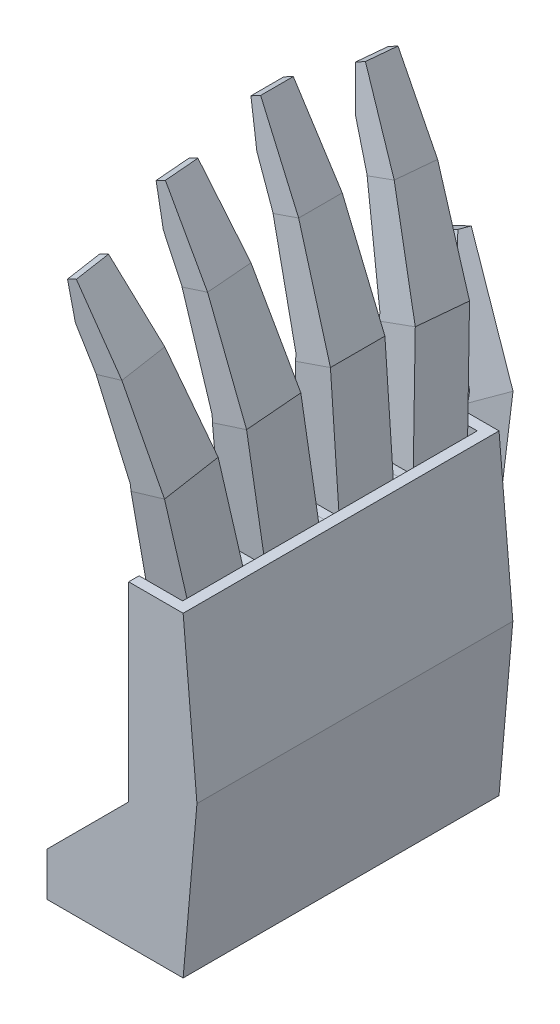
from build123d import *

# Parameters (mm, degrees)
EXTRUDE_1_DEPTH      = 29
CUT_EXTRUDE_1_DEPTH  = 8
EXTRUDE_3_DEPTH      = 5
EXTRUDE_4_DEPTH      = 5
EXTRUDE_7_DEPTH      = 5
EXTRUDE_8_DEPTH      = 5
CUT_EXTRUDE_2_DEPTH  = 8
CUT_EXTRUDE_3_DEPTH  = 8
CUT_EXTRUDE_4_DEPTH  = 8
CUT_EXTRUDE_5_DEPTH  = 8
EXTRUDE_9_DEPTH      = 4
EXTRUDE_9_DEPTH_BACK = 15
CUT_EXTRUDE_6_DEPTH  = 123.591294734
EXTRUDE_10_DEPTH     = 12
CUT_EXTRUDE_7_DEPTH  = 10
CUT_EXTRUDE_8_REACH  = 131.356
SKETCH_19_R          = 4
SKETCH_19_R_2        = 0.75
CUT_EXTRUDE_9_REACH  = 128.701
SKETCH_20_R          = 1.459599559
SKETCH_20_R_2        = 1.556195018
SKETCH_20_R_3        = 1.5


with BuildPart() as part:
    # 草图1 → 凸台-拉伸1 (new, symmetric)
    with BuildSketch(Plane.XY):
        Polygon((0, 0), (25, 0), (27.537171242, 29), (25, 58), (15, 58), (15, 23), (0, 8), align=None)
    extrude(amount=EXTRUDE_1_DEPTH, both=True)

    # 草图2 → 切除-拉伸1 (cut)
    with BuildSketch(Plane.ZY.offset(-15)):
        Polygon((-27, 58), (-27, 55.814681899), (-13.451752106, 57), (0.148247894, 57), (13.696495788, 55.814681899), (27.089881229, 53.453066682), (27.089881229, 58), align=None)
    extrude(amount=-CUT_EXTRUDE_1_DEPTH, mode=Mode.SUBTRACT)

    # 草图3 → 凸台-拉伸3 (add, symmetric)
    with BuildSketch(Plane(origin=(15, 56.407340949, -20.225876053), x_dir=(1, 0, 0), z_dir=(0, 0.08715574274765847, 0.9961946980917457))):
        Polygon((-9.323445702, 54.044998978), (-8.171455002, 46.660954361), (-4.917561857, 39.352590699), (0, 21), (0, 0), (8, 0), (6.465357578, 21.946409106), (-0.046005512, 40.856780618), (-7.557550516, 54.983942103), align=None)
    extrude(amount=EXTRUDE_3_DEPTH, both=True)

    # 草图4 → 凸台-拉伸4 (add, symmetric)
    with BuildSketch(Plane(origin=(15, 57, -6.651752106), x_dir=(1, 0, 0), z_dir=(0, 0, 1))):
        Polygon((0, 0), (8, 0), (6.395601104, 22.943973156), (-0.44133014, 42.799863244), (-8.422346707, 57.809972322), (-10.188241893, 56.871029197), (-8.633642368, 49.083652916), (-5.176380902, 41.318516526), (0, 22), align=None)
    extrude(amount=EXTRUDE_4_DEPTH, both=True)

    # 草图5 → 凸台-拉伸7 (add, symmetric)
    with BuildSketch(Plane(origin=(15, 56.407340949, 6.922371841), x_dir=(1, 0, 0), z_dir=(0, -0.08715574274765847, 0.9961946980917457))):
        Polygon((0, 0), (8, 0), (6.465357578, 21.946409106), (-0.046005512, 40.856780618), (-7.557550516, 54.983942103), (-9.323445702, 54.044998978), (-8.171455002, 46.660954361), (-4.917561857, 39.352590699), (0, 21), align=None)
    extrude(amount=EXTRUDE_7_DEPTH, both=True)

    # 草图6 → 凸台-拉伸8 (add, symmetric)
    with BuildSketch(Plane(origin=(15, 54.63387429, 20.393188509), x_dir=(1, 0, 0), z_dir=(0, -0.17364817766693064, 0.9848077530122081))):
        Polygon((0, 0), (8, 0), (6.535114051, 20.948845055), (0.674887271, 37.968179416), (-6.367186171, 51.212393309), (-8.133081356, 50.273450184), (-7.45044859, 43.272329979), (-4.399923767, 36.420739047), (0, 20), align=None)
    extrude(amount=EXTRUDE_8_DEPTH, both=True)

    # 草图9 → 切除-拉伸2 (cut)
    with BuildSketch(Plane(origin=(43.786407244, 15.019497062, -1.314035725), x_dir=(-0.027653196730496193, -0.006835672416694662, -0.9995942048117308), z_dir=(0.945518575599319, 0.32432926933772815, -0.028375134316697356))):
        Polygon((16.019101355, 67.443389025), (18.714253027, 87.286175055), (21.05291991, 102.947141542), (27.031237201, 102.437511905), (26.685342748, 86.606668873), (25.982963507, 66.594006296), (29.629783933, 109.373797793), (19.665921781, 110.223180522), align=None)
    extrude(amount=-CUT_EXTRUDE_2_DEPTH, mode=Mode.SUBTRACT)

    # 草图10 → 切除-拉伸3 (cut)
    with BuildSketch(Plane(origin=(43.736994655, 15.059854982, 0), x_dir=(0, 0, -1), z_dir=(0.9455185755993187, 0.32556815445715115, 0))):
        Polygon((1.651752106, 68.622785261), (2.651752106, 89.622785261), (3.651752106, 106.413487051), (9.651752106, 106.413487051), (10.651752106, 89.622785261), (11.651752106, 68.622785261), (11.651752106, 115.571899367), (1.651752106, 115.571899367), align=None)
    extrude(amount=-CUT_EXTRUDE_3_DEPTH, mode=Mode.SUBTRACT)

    # 草图11 → 切除-拉伸4 (cut)
    with BuildSketch(Plane(origin=(43.429484648, 14.897066422, 1.303324432), x_dir=(0.02765319673049623, 0.006835672416694678, -0.9995942048117308), z_dir=(0.9455185755993187, 0.32432926933772854, 0.028375134316697394))):
        Polygon((-12.684857793, 66.627338038), (-13.387237034, 86.640000614), (-13.733131487, 102.470843646), (-7.754814196, 102.980473283), (-5.416147313, 87.319506797), (-2.720995641, 67.476720766), (-6.546649191, 112.354351713), (-16.478235605, 111.126351676), align=None)
    extrude(amount=-CUT_EXTRUDE_4_DEPTH, mode=Mode.SUBTRACT)

    # 草图12 → 切除-拉伸5 (cut)
    with BuildSketch(Plane(origin=(43.353791536, 14.701119108, 2.592203945), x_dir=(0.05512742044977168, 0.013471340172277213, -0.9983884467022428), z_dir=(0.9455185755993187, 0.32062204264327854, 0.0565343167278701))):
        Polygon((-26.718901534, 63.408631661), (-28.781224347, 81.318037698), (-30.304296285, 96.088755689), (-24.390936546, 97.104716612), (-20.896744695, 82.672652262), (-16.863301969, 65.101899866), (-23.990371814, 106.58472359), (-33.845971379, 104.891455385), align=None)
    extrude(amount=-CUT_EXTRUDE_5_DEPTH, mode=Mode.SUBTRACT)

    # 草图13 → 凸台-拉伸9 (add, two sides: drawn at the far end of the back side and taken through both)
    with BuildSketch(Plane(origin=(0, 0, -29), x_dir=(-1, 0, 0), z_dir=(0, 0, -1)).offset(-EXTRUDE_9_DEPTH_BACK)):
        Polygon((-15, 42), (-21, 36), (-21, 0), (0, 0), (0, 27), align=None)
    extrude(amount=EXTRUDE_9_DEPTH + EXTRUDE_9_DEPTH_BACK)

    # 草图14 → 切除-拉伸6 (cut, through all)
    with BuildSketch(Plane.XZ):
        Polygon((21, -29), (3, -33), (0, -30), (0, -35.356420502), (21, -35.356420502), (21, -33), align=None)
    extrude(amount=-CUT_EXTRUDE_6_DEPTH, mode=Mode.SUBTRACT)

    # 草图17 → 凸台-拉伸10 (add)
    with BuildSketch(Plane(origin=(9.583983071, 5.668293949, 2.129774016), x_dir=(-0.4880935300919712, 0.8660254037844418, -0.10846522890932642), z_dir=(-0.845402792964955, -0.4999999999999946, -0.18786728732554522))):
        Polygon((28.095834077, 32.86496436), (43.684291345, 41.86496436), (54.517176629, 43.775094314), (63.782054485, 47.744457312), (63.607743, 49.736846708), (41.691459642, 47.819420367), (21.752688327, 38.521818609), (16.095834077, 32.86496436), align=None)
    extrude(amount=-EXTRUDE_10_DEPTH)

    # 草图18 → 切除-拉伸7 (cut)
    with BuildSketch(Plane(origin=(11.38136915, -3.321366881, -42.376498538), x_dir=(-0.9659724085627504, -0.020280380390013637, -0.25784881629884493), z_dir=(0.2586451260790556, -0.07547908730517995, -0.9630190061131331))):
        Polygon((1.682136929, 51.286517247), (14.512238635, 69.331973467), (20.638759875, 65.945863974), (12.184744769, 45.481758116), (26.51939396, 71.417580015), (15.357154401, 76.028860982), align=None)
    extrude(amount=-CUT_EXTRUDE_7_DEPTH, mode=Mode.SUBTRACT)

    # 切除-拉伸8: up to this plane
    cut_extrude_8_end = Plane(origin=(15, 23, 29), z_dir=(0.7071067811865438, -0.7071067811865512, 0))
    # 草图19 → 切除-拉伸8 (cut, up to the surface)
    with BuildSketch(Plane.XZ, mode=Mode.PRIVATE) as cut_extrude_8_sk1:
        with Locations(Location((9, 0, 0), (0, 0, 270))):
            Circle(SKETCH_19_R)
    cut_extrude_8_tool1 = split(extrude(cut_extrude_8_sk1.sketch, amount=-CUT_EXTRUDE_8_REACH, mode=Mode.PRIVATE), bisect_by=cut_extrude_8_end, keep=Keep.BOTH, mode=Mode.PRIVATE)
    add(cut_extrude_8_tool1.solids().sort_by_distance((9, 0, 0))[0], mode=Mode.SUBTRACT)
    # 草图19 → 切除-拉伸8 (cut, up to the surface)
    with BuildSketch(Plane.XZ, mode=Mode.PRIVATE) as cut_extrude_8_sk2:
        with Locations(Location((2.2, 0, 0), (0, 0, 270))):
            Circle(SKETCH_19_R_2)
    cut_extrude_8_tool2 = split(extrude(cut_extrude_8_sk2.sketch, amount=-CUT_EXTRUDE_8_REACH, mode=Mode.PRIVATE), bisect_by=cut_extrude_8_end, keep=Keep.BOTH, mode=Mode.PRIVATE)
    add(cut_extrude_8_tool2.solids().sort_by_distance((2.2, 0, 0))[0], mode=Mode.SUBTRACT)
    # 草图19 → 切除-拉伸8 (cut, up to the surface)
    with BuildSketch(Plane.XZ, mode=Mode.PRIVATE) as cut_extrude_8_sk3:
        with Locations(Location((9, 6.8, 0), (0, 0, 270))):
            Circle(SKETCH_19_R_2)
    cut_extrude_8_tool3 = split(extrude(cut_extrude_8_sk3.sketch, amount=-CUT_EXTRUDE_8_REACH, mode=Mode.PRIVATE), bisect_by=cut_extrude_8_end, keep=Keep.BOTH, mode=Mode.PRIVATE)
    add(cut_extrude_8_tool3.solids().sort_by_distance((9, 0, 6.8))[0], mode=Mode.SUBTRACT)
    # 草图19 → 切除-拉伸8 (cut, up to the surface)
    with BuildSketch(Plane.XZ, mode=Mode.PRIVATE) as cut_extrude_8_sk4:
        with Locations(Location((9, -6.8, 0), (0, 0, 270))):
            Circle(SKETCH_19_R_2)
    cut_extrude_8_tool4 = split(extrude(cut_extrude_8_sk4.sketch, amount=-CUT_EXTRUDE_8_REACH, mode=Mode.PRIVATE), bisect_by=cut_extrude_8_end, keep=Keep.BOTH, mode=Mode.PRIVATE)
    add(cut_extrude_8_tool4.solids().sort_by_distance((9, 0, -6.8))[0], mode=Mode.SUBTRACT)

    # 切除-拉伸9: up to this plane
    cut_extrude_9_end = Plane(origin=(15, 23, 29), z_dir=(0.7071067811865438, -0.7071067811865512, 0))
    # 草图20 → 切除-拉伸9 (cut, up to the surface)
    with BuildSketch(Plane(origin=(0, 3, 0), x_dir=(-1, 0, 0), z_dir=(0, -1, 0)), mode=Mode.PRIVATE) as cut_extrude_9_sk1:
        with Locations(Location((-9, 6.8, 0), (0, 0, 90))):
            Circle(SKETCH_20_R)
    cut_extrude_9_tool1 = split(extrude(cut_extrude_9_sk1.sketch, amount=-CUT_EXTRUDE_9_REACH, mode=Mode.PRIVATE), bisect_by=cut_extrude_9_end, keep=Keep.BOTH, mode=Mode.PRIVATE)
    add(cut_extrude_9_tool1.solids().sort_by_distance((9, 3, -6.8))[0], mode=Mode.SUBTRACT)
    # 草图20 → 切除-拉伸9 (cut, up to the surface)
    with BuildSketch(Plane(origin=(0, 3, 0), x_dir=(-1, 0, 0), z_dir=(0, -1, 0)), mode=Mode.PRIVATE) as cut_extrude_9_sk2:
        with Locations(Location((-2.2, 0, 0), (0, 0, 90))):
            Circle(SKETCH_20_R_2)
    cut_extrude_9_tool2 = split(extrude(cut_extrude_9_sk2.sketch, amount=-CUT_EXTRUDE_9_REACH, mode=Mode.PRIVATE), bisect_by=cut_extrude_9_end, keep=Keep.BOTH, mode=Mode.PRIVATE)
    add(cut_extrude_9_tool2.solids().sort_by_distance((2.2, 3, 0))[0], mode=Mode.SUBTRACT)
    # 草图20 → 切除-拉伸9 (cut, up to the surface)
    with BuildSketch(Plane(origin=(0, 3, 0), x_dir=(-1, 0, 0), z_dir=(0, -1, 0)), mode=Mode.PRIVATE) as cut_extrude_9_sk3:
        with Locations(Location((-9, -6.8, 0), (0, 0, 90))):
            Circle(SKETCH_20_R_3)
    cut_extrude_9_tool3 = split(extrude(cut_extrude_9_sk3.sketch, amount=-CUT_EXTRUDE_9_REACH, mode=Mode.PRIVATE), bisect_by=cut_extrude_9_end, keep=Keep.BOTH, mode=Mode.PRIVATE)
    add(cut_extrude_9_tool3.solids().sort_by_distance((9, 3, 6.8))[0], mode=Mode.SUBTRACT)


solid = part.part
